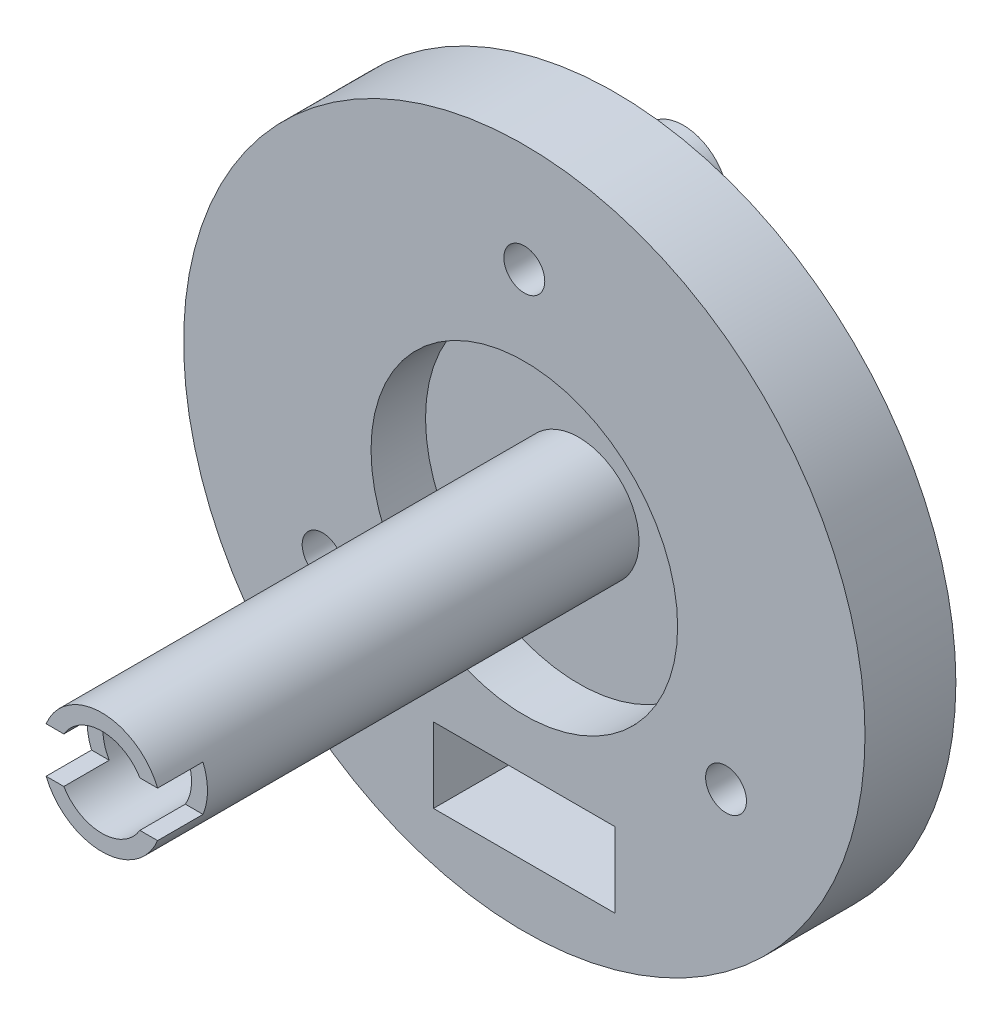
from build123d import *

# Parameters (mm, degrees)
SKETCH1_R             = 2
SKETCH1_R_2           = 0.9
BOSS_EXTRUDE1_DEPTH   = 3
BOSS_EXTRUDE1_2_DEPTH = 3
BOSS_EXTRUDE1_3_DEPTH = 3
SKETCH2_R             = 15
SKETCH2_R_2           = 1.95
BOSS_EXTRUDE2_DEPTH   = 4
SKETCH4_W             = 8
SKETCH4_H             = 3.3
CUT_EXTRUDE2_DEPTH    = 229.434345053
SKETCH5_R             = 6.75
CUT_EXTRUDE3_DEPTH    = 2.4
CUT_EXTRUDE5_DEPTH    = 1
SKETCH8_R             = 2.65
SKETCH8_R_2           = 1.95
BOSS_EXTRUDE3_DEPTH   = 21
SKETCH10_R            = 0.9
CUT_EXTRUDE6_DEPTH    = 230.514727196
SKETCH11_W            = 7
SKETCH11_H            = 2
CUT_EXTRUDE7_DEPTH    = 2


with BuildPart() as part:
    # Sketch1 → Boss-Extrude1 (new body)
    with BuildSketch(Plane.XY):
        with Locations((166.62, -116.13)):
            Circle(SKETCH1_R)
        with Locations((166.62, -116.13)):
            Circle(SKETCH1_R_2, mode=Mode.SUBTRACT)
    extrude(amount=BOSS_EXTRUDE1_DEPTH)



with BuildPart() as body_2:
    # Sketch1 → Boss-Extrude1 2 (new body)
    with BuildSketch(Plane.XY):
        with Locations((175.5, -100.75)):
            Circle(SKETCH1_R)
        with Locations((175.5, -100.75)):
            Circle(SKETCH1_R_2, mode=Mode.SUBTRACT)
    extrude(amount=BOSS_EXTRUDE1_2_DEPTH)


with BuildPart() as body_3:
    # Sketch1 → Boss-Extrude1 3 (new body)
    with BuildSketch(Plane.XY):
        with Locations((184.38, -116.13)):
            Circle(SKETCH1_R)
        with Locations((184.38, -116.13)):
            Circle(SKETCH1_R_2, mode=Mode.SUBTRACT)
    extrude(amount=BOSS_EXTRUDE1_3_DEPTH)


with BuildPart() as part_1:
    add(part.part)

    add(body_2.part)  # Boss-Extrude2 merges body 2

    add(body_3.part)  # Boss-Extrude2 merges body 3
    # Sketch2 → Boss-Extrude2 (add)
    with BuildSketch(Plane.XY.offset(3)):
        with Locations((175.5, -111)):
            Circle(SKETCH2_R)
        with Locations((175.5, -111)):
            Circle(SKETCH2_R_2, mode=Mode.SUBTRACT)
    extrude(amount=BOSS_EXTRUDE2_DEPTH)

    # Sketch4 → Cut-Extrude2 (cut, through all)
    with BuildSketch(Plane(origin=(0, 0, 3), x_dir=(-1, 0, 0), z_dir=(0, 0, -1))):
        with Locations((-175.5, -121.65)):
            Rectangle(SKETCH4_W, SKETCH4_H)
    extrude(amount=-CUT_EXTRUDE2_DEPTH, mode=Mode.SUBTRACT)

    # Sketch5 → Cut-Extrude3 (cut)
    with BuildSketch(Plane.XY.offset(7)):
        with Locations((175.5, -111)):
            Circle(SKETCH5_R)
    extrude(amount=-CUT_EXTRUDE3_DEPTH, mode=Mode.SUBTRACT)

    # Sketch6 → Cut-Extrude5 (cut)
    with BuildSketch(Plane(origin=(0, 0, 3), x_dir=(-1, 0, 0), z_dir=(0, 0, -1))):
        with BuildLine():
            Line((-173.55, -111), (-173.55, -120))
            ThreePointArc((-173.55, -120), (-175.5, -121.95), (-177.45, -120))
            Line((-177.45, -120), (-177.45, -111))
            ThreePointArc((-177.45, -111), (-175.5, -109.05), (-173.55, -111))
        make_face()
    extrude(amount=-CUT_EXTRUDE5_DEPTH, mode=Mode.SUBTRACT)

    # Sketch8 → Boss-Extrude3 (add)
    with BuildSketch(Plane.XY.offset(4.6)):
        with Locations(Location((175.5, -111, 0), (0, 0, 180))):
            Circle(SKETCH8_R)
        with Locations((175.5, -111)):
            Circle(SKETCH8_R_2, mode=Mode.SUBTRACT)
    extrude(amount=BOSS_EXTRUDE3_DEPTH)

    # Sketch10 → Cut-Extrude6 (cut, through all)
    with BuildSketch(Plane(origin=(0, 0, 3), x_dir=(-1, 0, 0), z_dir=(0, 0, -1))):
        with Locations(Location((-175.5, -100.75, 0), (0, 0, 180))):
            Circle(SKETCH10_R)
        with Locations(Location((-184.38, -116.13, 0), (0, 0, 180))):
            Circle(SKETCH10_R)
        with Locations(Location((-166.62, -116.13, 0), (0, 0, 180))):
            Circle(SKETCH10_R)
    extrude(amount=-CUT_EXTRUDE6_DEPTH, mode=Mode.SUBTRACT)

    # Sketch11 → Cut-Extrude7 (cut)
    with BuildSketch(Plane.XY.offset(25.6)):
        with Locations((175.5, -111)):
            Rectangle(SKETCH11_W, SKETCH11_H)
    extrude(amount=-CUT_EXTRUDE7_DEPTH, mode=Mode.SUBTRACT)


solid = part_1.part
